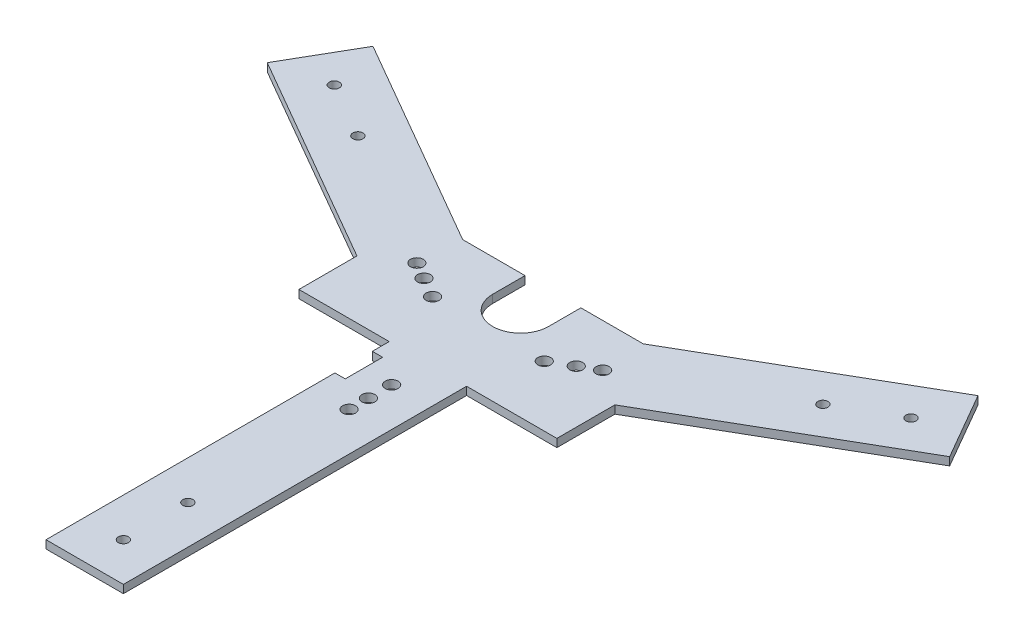
from build123d import *

# Parameters (mm, degrees)
SKETCH1_R           = 1.27
BOSS_EXTRUDE2_DEPTH = 1.5875
SKETCH6_W           = 2.032
SKETCH6_H           = 7.366
CUT_EXTRUDE4_DEPTH  = 2.54
SKETCH7_R           = 1
CUT_EXTRUDE5_DEPTH  = 2.54


with BuildPart() as part:
    # Sketch1 → Boss-Extrude2 (new body)
    with BuildSketch(Plane(origin=(0, 0, 0), x_dir=(1, 0, 0), z_dir=(0, 1, 0))):
        with BuildLine():
            Line((-41.794385987, 35.56), (0, 11.43))
            Line((0, 11.43), (0, 0))
            Line((0, 0), (17.78, 0))
            Line((17.78, 0), (17.78, -67.587878735))
            Line((17.78, -67.587878735), (33.02, -67.587878735))
            Line((33.02, -67.587878735), (33.02, 0))
            Line((33.02, 0), (50.8, 0))
            Line((50.8, 0), (50.8, 11.43))
            Line((50.8, 11.43), (92.594385987, 35.56))
            Line((92.594385987, 35.56), (84.974385987, 48.758227154))
            Line((84.974385987, 48.758227154), (43.18, 24.628227154))
            Line((43.18, 24.628227154), (30.9, 24.628227154))
            Line((30.9, 24.628227154), (30.9, 18.264121265))
            ThreePointArc((30.9, 18.264121265), (25.4, 12.764121265), (19.9, 18.264121265))
            Line((19.9, 18.264121265), (19.9, 24.628227154))
            Line((19.9, 24.628227154), (7.62, 24.628227154))
            Line((7.62, 24.628227154), (-34.174385987, 48.758227154))
            Line((-34.174385987, 48.758227154), (-41.794385987, 35.56))
        make_face()
        with Locations(Location((43.690443212, 16.124113577, 0), (0, 0, 270))):
            Circle(SKETCH1_R, mode=Mode.SUBTRACT)
        with Locations(Location((36.398522628, 11.914121265, 0), (0, 0, 270))):
            Circle(SKETCH1_R, mode=Mode.SUBTRACT)
        with Locations(Location((14.401477372, 11.914121265, 0), (0, 0, 270))):
            Circle(SKETCH1_R, mode=Mode.SUBTRACT)
        with Locations(Location((7.109556788, 16.124113577, 0), (0, 0, 270))):
            Circle(SKETCH1_R, mode=Mode.SUBTRACT)
        with Locations(Location((10.409113577, 14.219113577, 0), (0, 0, 270))):
            Circle(SKETCH1_R, mode=Mode.SUBTRACT)
        with Locations(Location((40.390886423, 14.219113577, 0), (0, 0, 270))):
            Circle(SKETCH1_R, mode=Mode.SUBTRACT)
        with Locations(Location((25.4, -7.135878735, 0), (0, 0, 270))):
            Circle(SKETCH1_R, mode=Mode.SUBTRACT)
        with Locations(Location((25.4, -15.517878735, 0), (0, 0, 270))):
            Circle(SKETCH1_R, mode=Mode.SUBTRACT)
        with Locations(Location((25.4, -11.707878735, 0), (0, 0, 270))):
            Circle(SKETCH1_R, mode=Mode.SUBTRACT)
    extrude(amount=BOSS_EXTRUDE2_DEPTH)

    # Sketch6 → Cut-Extrude4 (cut)
    with BuildSketch(Plane(origin=(0, 0, 0), x_dir=(-1, 0, 0), z_dir=(0, -1, 0))):
        with Locations((-18.796, -7.008878735)):
            Rectangle(SKETCH6_W, SKETCH6_H)
    extrude(amount=-CUT_EXTRUDE4_DEPTH, mode=Mode.SUBTRACT)

    # Sketch7 → Cut-Extrude5 (cut)
    with BuildSketch(Plane(origin=(0, 0, 0), x_dir=(-1, 0, 0), z_dir=(0, -1, 0))):
        with Locations(Location((-25.4, -59.967878735, 0), (0, 0, 90))):
            Circle(SKETCH7_R)
        with Locations(Location((-25.4, -47.267878735, 0), (0, 0, 90))):
            Circle(SKETCH7_R)
        with Locations(Location((-71.186749782, 31.999113577, 0), (0, 0, 90))):
            Circle(SKETCH7_R)
        with Locations(Location((-82.18527241, 38.349113577, 0), (0, 0, 90))):
            Circle(SKETCH7_R)
        with Locations(Location((31.38527241, 38.349113577, 0), (0, 0, 90))):
            Circle(SKETCH7_R)
        with Locations(Location((20.386749782, 31.999113577, 0), (0, 0, 90))):
            Circle(SKETCH7_R)
    extrude(amount=-CUT_EXTRUDE5_DEPTH, mode=Mode.SUBTRACT)


solid = part.part
